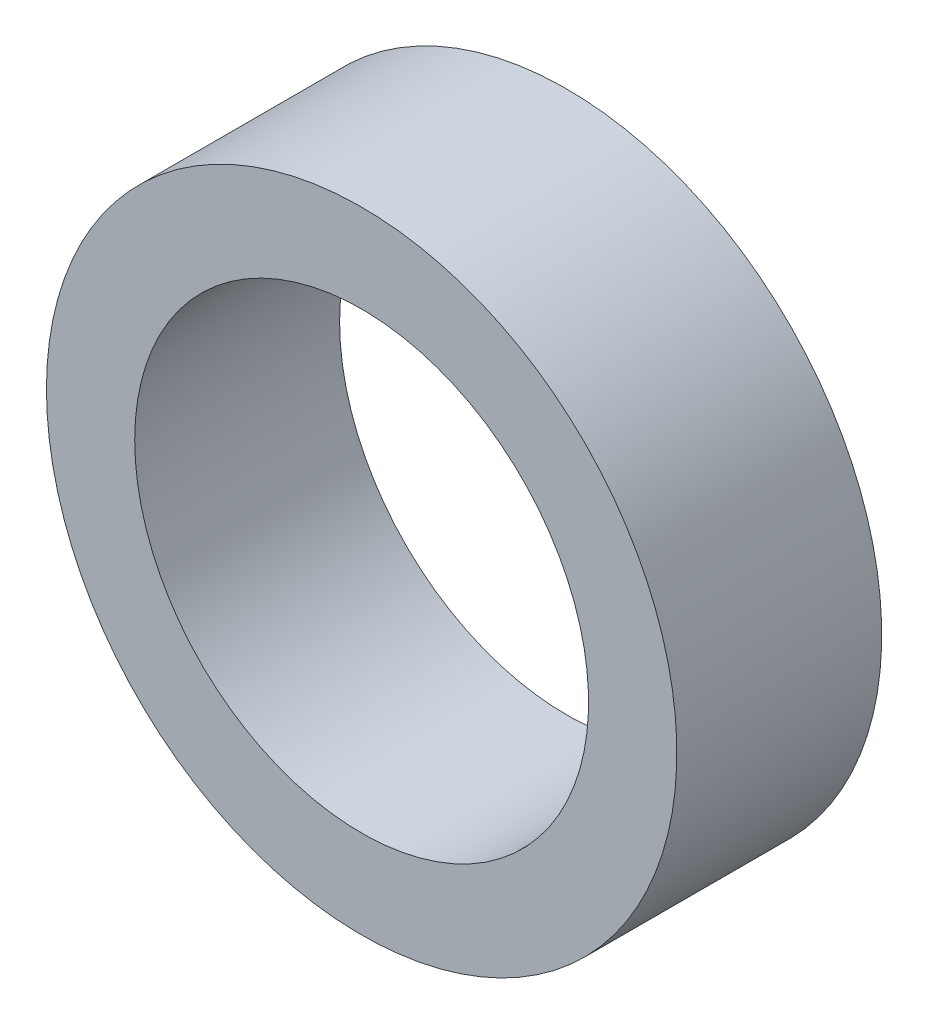
from build123d import *

# Parameters (mm, degrees)
SKETCH1_R           = 5
SKETCH1_R_2         = 3.6
BOSS_EXTRUDE1_DEPTH = 1.625


with BuildPart() as part:
    # Sketch1 → Boss-Extrude1 (new, symmetric)
    with BuildSketch(Plane.XY):
        Circle(SKETCH1_R)
        Circle(SKETCH1_R_2, mode=Mode.SUBTRACT)
    extrude(amount=BOSS_EXTRUDE1_DEPTH, both=True)


solid = part.part
